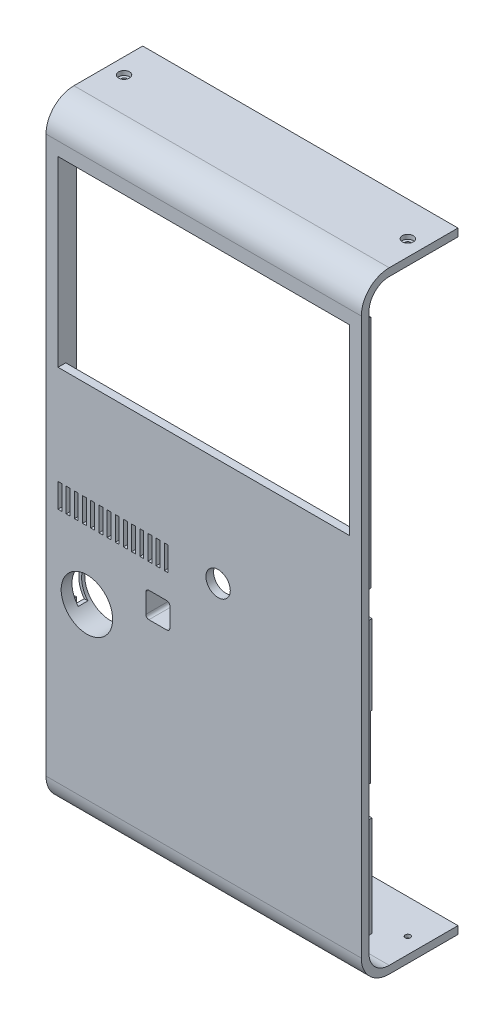
from build123d import *

# Parameters (mm, degrees)
SALIENTE_EXTRUIR1_DEPTH    = 131.1
CROQUIS3_R                 = 1.1
CORTAR_EXTRUIR1_DEPTH      = 289.575068223
CROQUIS4_R                 = 10.7
CROQUIS4_R_2               = 5.07
CROQUIS4_W                 = 121.1
CROQUIS4_H                 = 75.8
CROQUIS4_W_2               = 1.6
CROQUIS4_H_2               = 10
CROQUIS4_W_3               = 10
CROQUIS4_H_3               = 10.6
CORTAR_EXTRUIR2_DEPTH      = 287.189954401
CROQUIS7_W                 = 1.36
CROQUIS7_H                 = 98
CROQUIS7_W_2               = 1.86
CROQUIS7_H_2               = 41.6
SALIENTE_EXTRUIR2_DEPTH    = 4.4
CROQUIS8_R                 = 2.27
CORTAR_EXTRUIR3_DEPTH      = 1.8
CORTAR_EXTRUIR4_START      = -1.8
CROQUIS9_R                 = 2.27
CORTAR_EXTRUIR4_DEPTH      = 1.8
CROQUIS10_R                = 11.9
CROQUIS10_R_2              = 10.7
CROQUIS10_W                = 12.4
CROQUIS10_H                = 13
CROQUIS10_W_2              = 10
CROQUIS10_H_2              = 10.6
SALIENTE_EXTRUIR4_DEPTH    = 6.6
REDONDEO2_R                = 1.28
CORTAR_EXTRUIR5_REACH      = 292.482
CORTAR_EXTRUIR5_END_RADIUS = 10.7
CROQUIS11_W                = 4
CROQUIS11_H                = 14
SALIENTE_EXTRUIR6_START    = 1
CROQUIS13_W                = 12.4
CROQUIS13_H                = 13
SALIENTE_EXTRUIR6_DEPTH    = 1
CROQUIS14_R                = 3.2
CROQUIS14_R_2              = 1.5
SALIENTE_EXTRUIR7_DEPTH    = 8.4
REDONDEO3_R                = 3.84
CROQUIS17_W                = 4.4
CROQUIS17_H                = 0.4
CORTAR_EXTRUIR6_DEPTH      = 285.106479335
REDONDEO4_R                = 1.6
CROQUIS19_R                = 1.12
SALIENTE_EXTRUIR8_DEPTH    = 6.6
REDONDEO5_R                = 1
CORTAR_EXTRUIR8_START      = -1.86
CROQUIS21_W                = 0.6
CROQUIS21_H                = 26
CORTAR_EXTRUIR8_DEPTH      = 1.86
CROQUIS23_W                = 121.1
CROQUIS23_H                = 0.1
CORTAR_EXTRUIR9_DEPTH      = 287.189954401


with BuildPart() as part:
    # Croquis2 → Saliente-Extruir1 (new body)
    with BuildSketch(Plane(origin=(0, 0, 0), x_dir=(0, 0, -1), z_dir=(1, 0, 0))):
        with BuildLine():
            Line((37, 0), (37, -3.2))
            Line((37, -3.2), (8.4, -3.2))
            ThreePointArc((8.4, -3.2), (0.197561338, 0.197561338), (-3.2, 8.4))
            Line((-3.2, 8.4), (-3.2, 239.6))
            ThreePointArc((-3.2, 239.6), (0.197561338, 247.802438662), (8.4, 251.2))
            Line((8.4, 251.2), (37, 251.2))
            Line((37, 251.2), (37, 248))
            Line((37, 248), (8.4, 248))
            ThreePointArc((8.4, 248), (2.460303038, 245.539696962), (0, 239.6))
            Line((0, 239.6), (0, 8.4))
            ThreePointArc((0, 8.4), (2.460303038, 2.460303038), (8.4, 0))
            Line((8.4, 0), (37, 0))
        make_face()
    extrude(amount=SALIENTE_EXTRUIR1_DEPTH)

    # Croquis3 → Cortar-Extruir1 (cut, through all)
    with BuildSketch(Plane(origin=(0, 251.2, 0), x_dir=(1, 0, 0), z_dir=(0, 1, 0))):
        with Locations(Location((6.55, 22.7, 0), (0, 0, 270))):
            Circle(CROQUIS3_R)
        with Locations(Location((124.55, 22.7, 0), (0, 0, 270))):
            Circle(CROQUIS3_R)
    extrude(amount=-CORTAR_EXTRUIR1_DEPTH, mode=Mode.SUBTRACT)

    # Croquis4 → Cortar-Extruir2 (cut, through all)
    with BuildSketch(Plane.XY.offset(3.2)):
        with Locations((17, 78.7)):
            Circle(CROQUIS4_R)
        with Locations((71.55, 113.5)):
            Circle(CROQUIS4_R_2)
        with Locations((65.55, 196.1)):
            Rectangle(CROQUIS4_W, CROQUIS4_H)
        with Locations((9.2, 112)):
            Rectangle(CROQUIS4_W_2, CROQUIS4_H_2)
        with Locations((46.5, 91.4)):
            Rectangle(CROQUIS4_W_3, CROQUIS4_H_3)
        with Locations((5.8, 112)):
            Rectangle(CROQUIS4_W_2, CROQUIS4_H_2)
        with Locations((12.6, 112)):
            Rectangle(CROQUIS4_W_2, CROQUIS4_H_2)
        with Locations((16, 112)):
            Rectangle(CROQUIS4_W_2, CROQUIS4_H_2)
        with Locations((19.4, 112)):
            Rectangle(CROQUIS4_W_2, CROQUIS4_H_2)
        with Locations((22.8, 112)):
            Rectangle(CROQUIS4_W_2, CROQUIS4_H_2)
        with Locations((26.2, 112)):
            Rectangle(CROQUIS4_W_2, CROQUIS4_H_2)
        with Locations((29.6, 112)):
            Rectangle(CROQUIS4_W_2, CROQUIS4_H_2)
        with Locations((33, 112)):
            Rectangle(CROQUIS4_W_2, CROQUIS4_H_2)
        with Locations((36.4, 112)):
            Rectangle(CROQUIS4_W_2, CROQUIS4_H_2)
        with Locations((39.8, 112)):
            Rectangle(CROQUIS4_W_2, CROQUIS4_H_2)
        with Locations((43.2, 112)):
            Rectangle(CROQUIS4_W_2, CROQUIS4_H_2)
        with Locations((46.6, 112)):
            Rectangle(CROQUIS4_W_2, CROQUIS4_H_2)
        with Locations((50, 112)):
            Rectangle(CROQUIS4_W_2, CROQUIS4_H_2)
    extrude(amount=-CORTAR_EXTRUIR2_DEPTH, mode=Mode.SUBTRACT)

    # Croquis7 → Saliente-Extruir2 (add)
    with BuildSketch(Plane(origin=(0, 0, 0), x_dir=(-1, 0, 0), z_dir=(0, 0, -1))):
        Polygon((-127.46, 125.3), (-127.96, 125.3), (-127.96, 66.3), (-127.46, 66.3), (-126.1, 66.3), (-126.1, 125.3), align=None)
        with Locations((-126.78, 185)):
            Rectangle(CROQUIS7_W, CROQUIS7_H)
        with Locations((-4.32, 185)):
            Rectangle(CROQUIS7_W, CROQUIS7_H)
        Polygon((-3.64, 125.3), (-5, 125.3), (-5, 66.3), (-3.64, 66.3), (-3.14, 66.3), (-3.14, 125.3), align=None)
        with Locations((-127.03, 32.7)):
            Rectangle(CROQUIS7_W_2, CROQUIS7_H_2)
        with Locations((-4.07, 32.7)):
            Rectangle(CROQUIS7_W_2, CROQUIS7_H_2)
    extrude(amount=SALIENTE_EXTRUIR2_DEPTH)

    # Croquis8 → Cortar-Extruir3 (cut)
    with BuildSketch(Plane(origin=(0, 251.2, 0), x_dir=(1, 0, 0), z_dir=(0, 1, 0))):
        with Locations(Location((6.55, 22.7, 0), (0, 0, 270))):
            Circle(CROQUIS8_R)
        with Locations(Location((124.55, 22.7, 0), (0, 0, 270))):
            Circle(CROQUIS8_R)
    extrude(amount=-CORTAR_EXTRUIR3_DEPTH, mode=Mode.SUBTRACT)

    # Croquis9 → Cortar-Extruir4 (cut)
    with BuildSketch(Plane.XZ.offset(3.2).offset(CORTAR_EXTRUIR4_START)):
        with Locations(Location((124.55, -22.7, 0), (0, 0, 90))):
            Circle(CROQUIS9_R)
        with Locations(Location((6.55, -22.7, 0), (0, 0, 90))):
            Circle(CROQUIS9_R)
    extrude(amount=CORTAR_EXTRUIR4_DEPTH, mode=Mode.SUBTRACT)

    # Croquis10 → Saliente-Extruir4 (add)
    # profile 1 of 2: a face of its own
    with BuildSketch(Plane(origin=(0, 0, 0), x_dir=(-1, 0, 0), z_dir=(0, 0, -1))):
        with Locations(Location((-17, 78.7, 0), (0, 0, 180))):
            Circle(CROQUIS10_R)
        with Locations(Location((-17, 78.7, 0), (0, 0, 180))):
            Circle(CROQUIS10_R_2, mode=Mode.SUBTRACT)
    # profile 2 of 2: a face of its own
    with BuildSketch(Plane(origin=(0, 0, 0), x_dir=(-1, 0, 0), z_dir=(0, 0, -1))):
        with Locations((-46.5, 91.4)):
            Rectangle(CROQUIS10_W, CROQUIS10_H)
        with Locations((-46.5, 91.4)):
            Rectangle(CROQUIS10_W_2, CROQUIS10_H_2, mode=Mode.SUBTRACT)
    extrude(amount=SALIENTE_EXTRUIR4_DEPTH)

    # Redondeo2
    redondeo2_edges = [part.edges().sort_by_distance(p)[0] for p in [
        (41.5, 86.1, -1.7),
        (41.5, 96.7, -1.7),
        (51.5, 96.7, -1.7),
        (51.5, 86.1, -1.7),
    ]]
    fillet(redondeo2_edges, radius=REDONDEO2_R)

    # Cortar-Extruir5: up to this cylinder (the profile starts outside it)
    cortar_extruir5_end = Plane(origin=(17, 78.7, -3.3), z_dir=(0, 0, 1)) * Cylinder(CORTAR_EXTRUIR5_END_RADIUS, 607.364, mode=Mode.PRIVATE)
    # Croquis11 → Cortar-Extruir5 (cut, up to the surface)
    with BuildSketch(Plane.ZY.offset(10), mode=Mode.PRIVATE) as cortar_extruir5_sk1:
        with Locations((-3.3, 78.7)):
            Rectangle(CROQUIS11_W, CROQUIS11_H)
    cortar_extruir5_tool1 = extrude(cortar_extruir5_sk1.sketch, amount=-CORTAR_EXTRUIR5_REACH, mode=Mode.PRIVATE) - cortar_extruir5_end
    add(cortar_extruir5_tool1.solids().sort_by_distance((-10, 78.7, -3.3))[0], mode=Mode.SUBTRACT)

    # Croquis13 → Saliente-Extruir6 (add)
    with BuildSketch(Plane(origin=(0, 0, -6.6), x_dir=(-1, 0, 0), z_dir=(0, 0, -1)).offset(SALIENTE_EXTRUIR6_START)):
        with Locations((-46.5, 91.4)):
            Rectangle(CROQUIS13_W, CROQUIS13_H)
        with BuildLine():
            ThreePointArc((-50.22, 86.1), (-51.12509668, 86.47490332), (-51.5, 87.38))
            Line((-51.5, 87.38), (-51.5, 95.42))
            ThreePointArc((-51.5, 95.42), (-51.12509668, 96.32509668), (-50.22, 96.7))
            Line((-50.22, 96.7), (-42.78, 96.7))
            ThreePointArc((-42.78, 96.7), (-41.87490332, 96.32509668), (-41.5, 95.42))
            Line((-41.5, 95.42), (-41.5, 87.38))
            ThreePointArc((-41.5, 87.38), (-41.87490332, 86.47490332), (-42.78, 86.1))
            Line((-42.78, 86.1), (-50.22, 86.1))
        make_face(mode=Mode.SUBTRACT)
    extrude(amount=-SALIENTE_EXTRUIR6_DEPTH)

    # Croquis14 → Saliente-Extruir7 (add)
    with BuildSketch(Plane(origin=(0, 0, 0), x_dir=(-1, 0, 0), z_dir=(0, 0, -1))):
        with Locations(Location((-71.55, 88.8, 0), (0, 0, 180))):
            Circle(CROQUIS14_R)
        with Locations((-71.55, 88.8)):
            Circle(CROQUIS14_R_2, mode=Mode.SUBTRACT)
    extrude(amount=SALIENTE_EXTRUIR7_DEPTH)

    # Redondeo3
    redondeo3_edges = [part.edges().sort_by_distance(p)[0] for p in [
        (68.35, 88.8, 0),
    ]]
    fillet(redondeo3_edges, radius=REDONDEO3_R)

    # Croquis17 → Cortar-Extruir6 (cut, through all)
    with BuildSketch(Plane(origin=(127.46, 0, 0), x_dir=(0, 0, -1), z_dir=(1, 0, 0))):
        with Locations((2.2, 233.8)):
            Rectangle(CROQUIS17_W, CROQUIS17_H)
    extrude(amount=-CORTAR_EXTRUIR6_DEPTH, mode=Mode.SUBTRACT)

    # Redondeo4
    redondeo4_edges = [part.edges().sort_by_distance(p)[0] for p in [
        (52.7, 91.4, 0),
        (40.3, 91.4, 0),
    ]]
    fillet(redondeo4_edges, radius=REDONDEO4_R)

    # Croquis19 → Saliente-Extruir8 (add)
    with BuildSketch(Plane(origin=(0, 0, 0), x_dir=(-1, 0, 0), z_dir=(0, 0, -1))):
        with Locations((-17, 90.6)):
            Circle(CROQUIS19_R)
        with Locations((-17, 66.8)):
            Circle(CROQUIS19_R)
    extrude(amount=SALIENTE_EXTRUIR8_DEPTH)

    # Redondeo5
    redondeo5_edges = [part.edges().sort_by_distance(p)[0] for p in [
        (28.9, 78.7, 0),
    ]]
    fillet(redondeo5_edges, radius=REDONDEO5_R)

    # Croquis21 → Cortar-Extruir8 (cut)
    with BuildSketch(Plane(origin=(127.96, 0, 0), x_dir=(0, 0, -1), z_dir=(1, 0, 0)).offset(CORTAR_EXTRUIR8_START)):
        with Locations((4.1, 79.3)):
            Rectangle(CROQUIS21_W, CROQUIS21_H)
    extrude(amount=CORTAR_EXTRUIR8_DEPTH, mode=Mode.SUBTRACT)

    # Croquis23 → Cortar-Extruir9 (cut, through all)
    with BuildSketch(Plane.XY.offset(3.2)):
        with Locations((65.55, 158.15)):
            Rectangle(CROQUIS23_W, CROQUIS23_H)
    extrude(amount=-CORTAR_EXTRUIR9_DEPTH, mode=Mode.SUBTRACT)


solid = part.part
